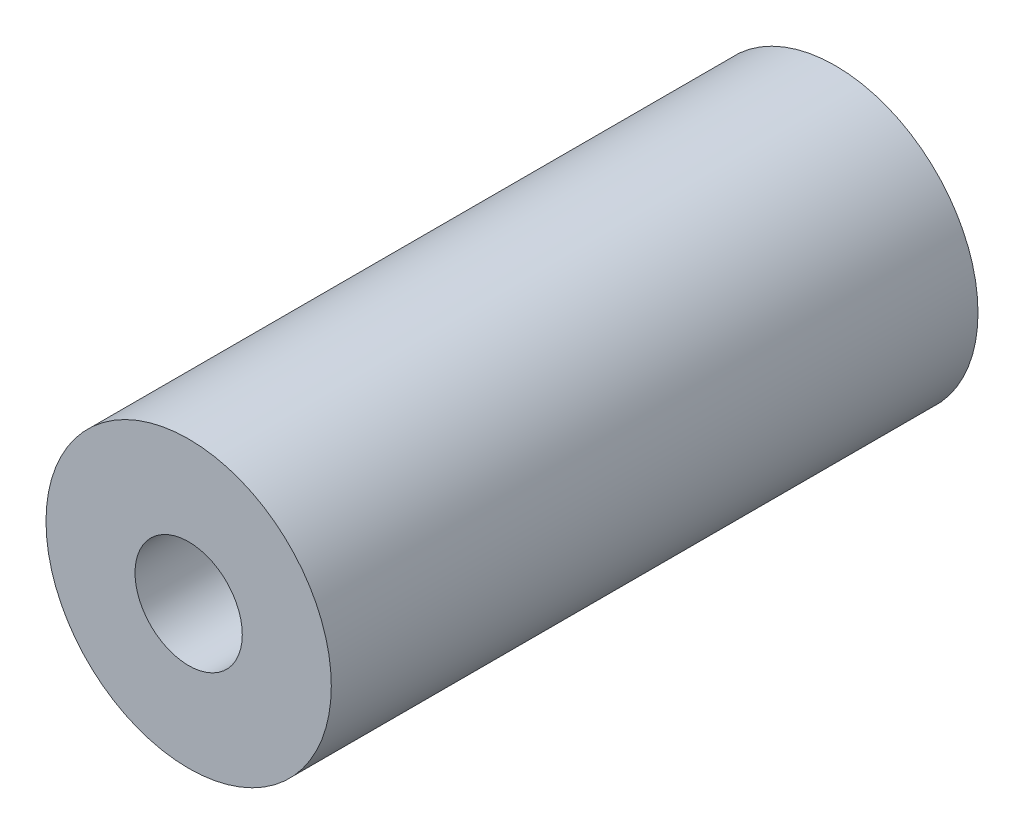
from build123d import *

# Parameters (mm, degrees)
SKETCH1_R           = 3.75
SKETCH1_R_2         = 1.41
BOSS_EXTRUDE1_DEPTH = 17


with BuildPart() as part:
    # Sketch1 → Boss-Extrude1 (new body)
    with BuildSketch(Plane.XY):
        Circle(SKETCH1_R)
        Circle(SKETCH1_R_2, mode=Mode.SUBTRACT)
    extrude(amount=BOSS_EXTRUDE1_DEPTH)


solid = part.part
